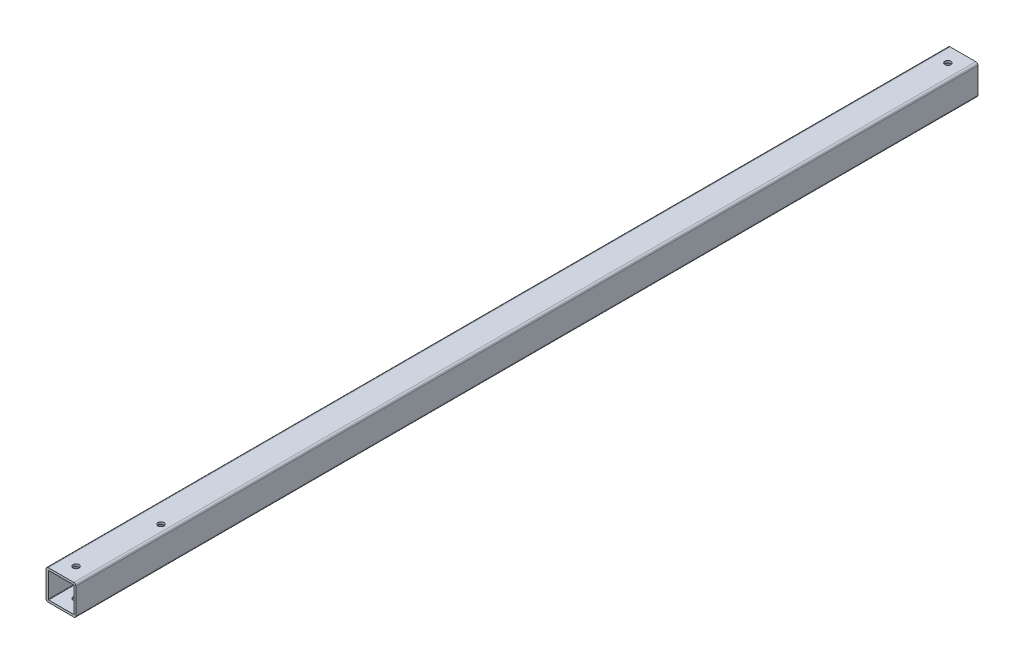
from build123d import *

# Parameters (mm, degrees)
SKETCH1_W                = 40
SKETCH1_H                = 40
SKETCH1_W_2              = 34
SKETCH1_H_2              = 34
EXTRUDE_THIN1_DEPTH      = 1200
FILLET1_R                = 0.5
FILLET2_R                = 3
F_8_0_8_DIAMETER_HOLE1_D = 8
SKETCH5_R                = 4
CUT_EXTRUDE1_DEPTH       = 1201.833044182


with BuildPart() as part:
    # Sketch1 → Extrude-Thin1 (new body)
    with BuildSketch(Plane.XY):
        Rectangle(SKETCH1_W, SKETCH1_H)
        Rectangle(SKETCH1_W_2, SKETCH1_H_2, mode=Mode.SUBTRACT)
    extrude(amount=EXTRUDE_THIN1_DEPTH)

    # Fillet1
    fillet1_edges = [part.edges().sort_by_distance(p)[0] for p in [
        (17, -17, 600),
        (17, 17, 600),
        (-17, 17, 600),
        (-17, -17, 600),
    ]]
    fillet(fillet1_edges, radius=FILLET1_R)

    # Fillet2
    fillet2_edges = [part.edges().sort_by_distance(p)[0] for p in [
        (20, -20, 600),
        (-20, -20, 600),
        (-20, 20, 600),
        (20, 20, 600),
    ]]
    fillet(fillet2_edges, radius=FILLET2_R)

    # Ø8.0 (8) Diameter Hole1 (through all)
    with Locations(Plane(origin=(0, 20, 0), x_dir=(1, 0, 0), z_dir=(0, 1, 0))):
        with Locations((0, -20), (0, -1180)):
            Hole(F_8_0_8_DIAMETER_HOLE1_D / 2)

    # Sketch5 → Cut-Extrude1 (cut, through all)
    with BuildSketch(Plane(origin=(0, 20, 0), x_dir=(1, 0, 0), z_dir=(0, 1, 0))):
        with Locations(Location((8, -1075, 0), (0, 0, 270))):
            Circle(SKETCH5_R)
    extrude(amount=-CUT_EXTRUDE1_DEPTH, mode=Mode.SUBTRACT)


solid = part.part
